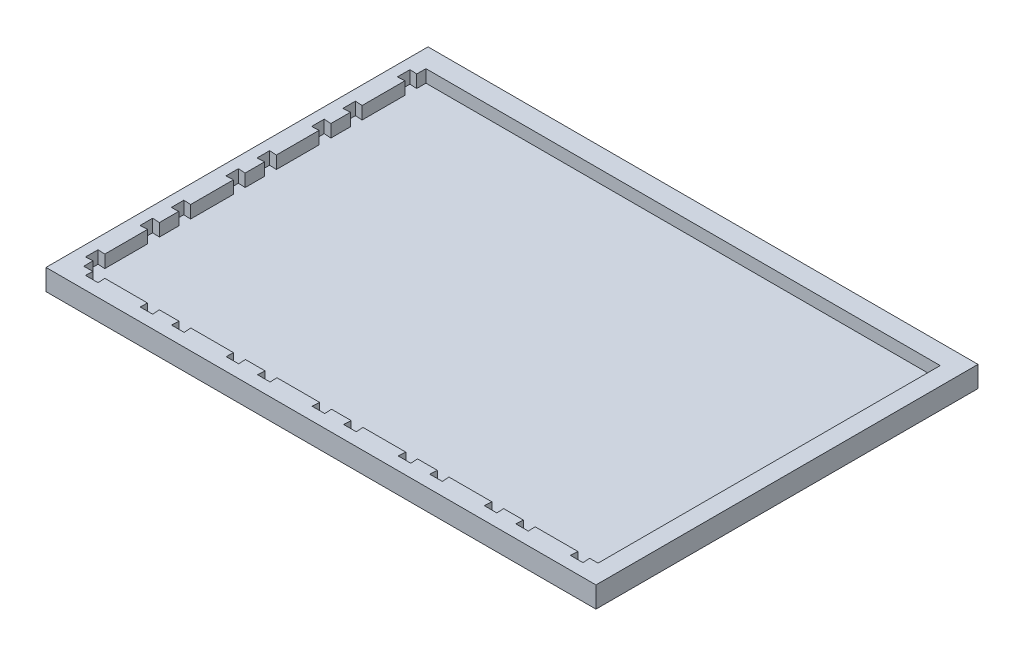
from build123d import *

# Parameters (mm, degrees)
SKETCH1_W           = 131
SKETCH1_H           = 91
BOSS_EXTRUDE1_DEPTH = 5
CUT_EXTRUDE2_DEPTH  = 3


with BuildPart() as part:
    # Sketch1 → Boss-Extrude1 (new body)
    with BuildSketch(Plane(origin=(0, 0, 0), x_dir=(1, 0, 0), z_dir=(0, 1, 0))):
        Rectangle(SKETCH1_W, SKETCH1_H)
    extrude(amount=BOSS_EXTRUDE1_DEPTH)

    # Sketch3 → Cut-Extrude2 (cut)
    with BuildSketch(Plane(origin=(0, 5, 0), x_dir=(1, 0, 0), z_dir=(0, 1, 0))):
        Polygon((-61.25, -38.55), (-61.25, -40.75), (-59.05, -40.75), (-59.15, -42.45), (-56.15, -42.45), (-56.25, -40.75), (-46.05, -40.75), (-46.15, -42.45), (-43.15, -42.45), (-43.25, -40.75), (-38.55, -40.75), (-38.65, -42.45), (-35.65, -42.45), (-35.75, -40.75), (-25.55, -40.75), (-25.65, -42.45), (-22.65, -42.45), (-22.75, -40.75), (-18.05, -40.75), (-18.15, -42.45), (-15.15, -42.45), (-15.25, -40.75), (-5.05, -40.75), (-5.15, -42.45), (-2.15, -42.45), (-2.25, -40.75), (2.45, -40.75), (2.35, -42.45), (5.35, -42.45), (5.25, -40.75), (15.45, -40.75), (15.35, -42.45), (18.35, -42.45), (18.25, -40.75), (22.95, -40.75), (22.85, -42.45), (25.85, -42.45), (25.75, -40.75), (35.95, -40.75), (35.85, -42.45), (38.85, -42.45), (38.75, -40.75), (43.45, -40.75), (43.35, -42.45), (46.35, -42.45), (46.25, -40.75), (56.45, -40.75), (56.35, -42.45), (59.35, -42.45), (59.25, -40.75), (61.25, -40.75), (61.25, 40.75), (-61.25, 40.75), (-61.25, 38.55), (-62.95, 38.65), (-62.95, 35.65), (-61.25, 35.75), (-61.25, 25.55), (-62.95, 25.65), (-62.95, 22.65), (-61.25, 22.75), (-61.25, 18.116666667), (-62.95, 18.216666667), (-62.95, 15.216666667), (-61.25, 15.316666667), (-61.25, 5.116666667), (-62.95, 5.216666667), (-62.95, 2.216666667), (-61.25, 2.316666667), (-61.25, -2.316666667), (-62.95, -2.216666667), (-62.95, -5.216666667), (-61.25, -5.116666667), (-61.25, -15.316666667), (-62.95, -15.216666667), (-62.95, -18.216666667), (-61.25, -18.116666667), (-61.25, -22.75), (-62.95, -22.65), (-62.95, -25.65), (-61.25, -25.55), (-61.25, -35.75), (-62.95, -35.65), (-62.95, -38.65), align=None)
    extrude(amount=-CUT_EXTRUDE2_DEPTH, mode=Mode.SUBTRACT)


solid = part.part
